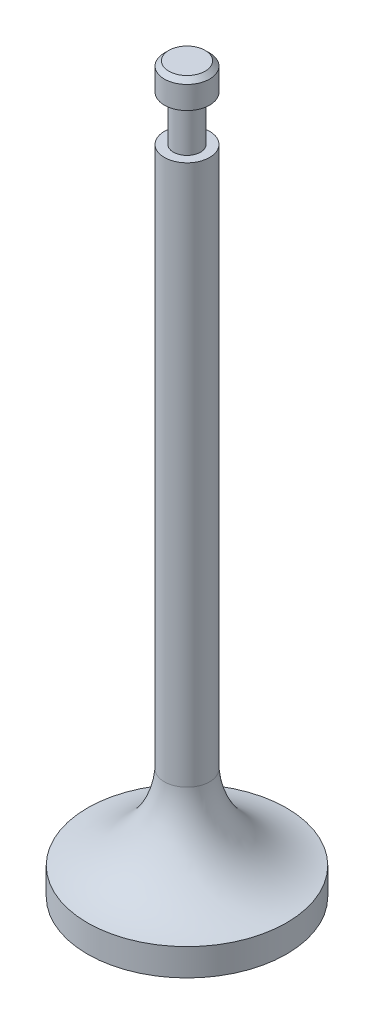
from build123d import *

# Parameters (mm, degrees)
CHAMFER1_SIZE = 0.5


with BuildPart() as part:
    # Sketch1 → Revolve1 (revolve)
    with BuildSketch(Plane.XY, mode=Mode.PRIVATE) as revolve1_sk:
        with BuildLine():
            Line((0, 0), (11, 0))
            Line((11, 0), (11, 3))
            ThreePointArc((11, 3), (5.117826553, 6.121629363), (2.5, 12.244661169))
            Line((2.5, 12.244661169), (2.5, 72))
            Line((2.5, 72), (1.5, 72))
            Line((1.5, 72), (1.5, 77))
            Line((1.5, 77), (2.5, 77))
            Line((2.5, 77), (2.5, 80))
            Line((2.5, 80), (0, 80))
            Line((0, 80), (0, 0))
        make_face()
    revolve(revolve1_sk.sketch.rotate(Axis((0, 80, 0), (0, -1, 0)), 180), axis=Axis((0, 80, 0), (0, -1, 0)))

    # Chamfer1
    chamfer1_edges = [part.edges().sort_by_distance(p)[0] for p in [
        (2.5, 80, 0),
    ]]
    chamfer(chamfer1_edges, length=CHAMFER1_SIZE)


solid = part.part
